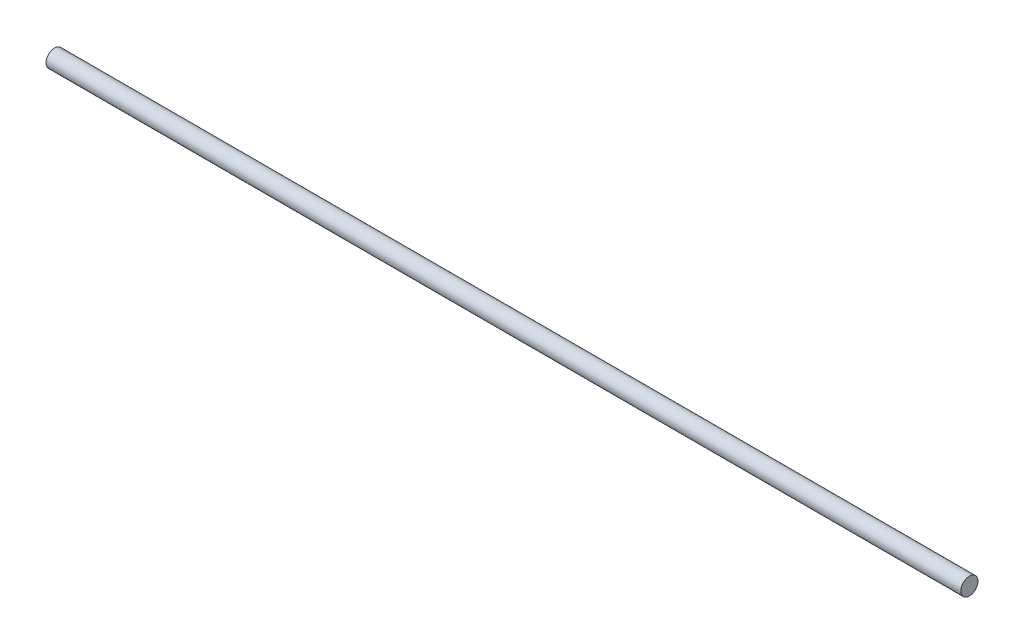
from build123d import *

# Parameters (mm, degrees)
SKETCH1_R           = 4
BOSS_EXTRUDE1_DEPTH = 425


with BuildPart() as part:
    # Sketch1 → Boss-Extrude1 (new body)
    with BuildSketch(Plane(origin=(0, 0, 0), x_dir=(0, 0, -1), z_dir=(1, 0, 0))):
        Circle(SKETCH1_R)
    extrude(amount=BOSS_EXTRUDE1_DEPTH)


solid = part.part
